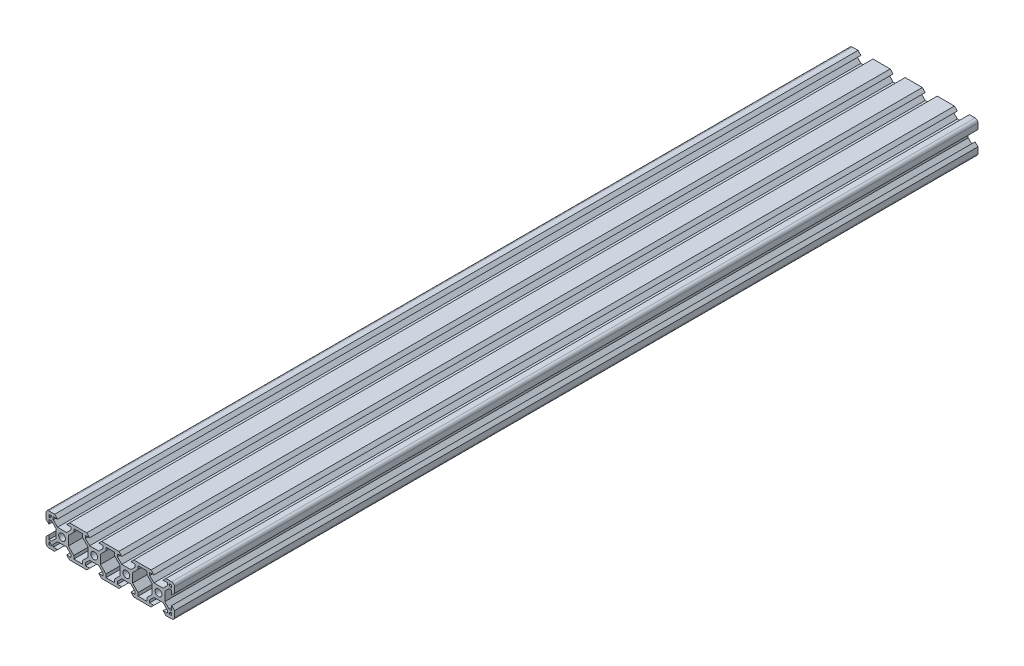
from build123d import *

# Parameters (mm, degrees)
ESQUISSE1_R        = 2.1
BOSS_EXTRU_1_DEPTH = 250


with BuildPart() as part:
    # Esquisse1 → Boss.-Extru.1 (new, symmetric)
    with BuildSketch(Plane.XY):
        with BuildLine():
            Line((-38.199999929, 10), (-34.639999675, 10))
            Line((-34.639999675, 10), (-32.839999603, 8.2))
            Line((-32.839999603, 8.2), (-35.499339671, 8.2))
            Line((-35.499339671, 8.2), (-35.499339671, 6.56))
            Line((-35.499339671, 6.56), (-32.839999603, 3.900660038))
            Line((-32.839999603, 3.900660038), (-27.159999603, 3.900660038))
            Line((-27.159999603, 3.900660038), (-24.500659536, 6.56))
            Line((-24.500659536, 6.56), (-24.500659536, 8.2))
            Line((-24.500659536, 8.2), (-27.159999603, 8.2))
            Line((-27.159999603, 8.2), (-25.359999532, 10))
            Line((-25.359999532, 10), (-14.640000468, 10))
            Line((-14.640000468, 10), (-12.840000397, 8.2))
            Line((-12.840000397, 8.2), (-15.499340464, 8.2))
            Line((-15.499340464, 8.2), (-15.499340464, 6.56))
            Line((-15.499340464, 6.56), (-12.840000397, 3.900660038))
            Line((-12.840000397, 3.900660038), (-7.159998809, 3.900660038))
            Line((-7.159998809, 3.900660038), (-4.500658742, 6.56))
            Line((-4.500658742, 6.56), (-4.500658742, 8.2))
            Line((-4.500658742, 8.2), (-7.159998809, 8.2))
            Line((-7.159998809, 8.2), (-5.359998738, 10))
            Line((-5.359998738, 10), (5.359998738, 10))
            Line((5.359998738, 10), (7.159998809, 8.2))
            Line((7.159998809, 8.2), (4.500658742, 8.2))
            Line((4.500658742, 8.2), (4.500658742, 6.56))
            Line((4.500658742, 6.56), (7.159998809, 3.900660038))
            Line((7.159998809, 3.900660038), (12.840000397, 3.900660038))
            Line((12.840000397, 3.900660038), (15.499340464, 6.56))
            Line((15.499340464, 6.56), (15.499340464, 8.2))
            Line((15.499340464, 8.2), (12.840000397, 8.2))
            Line((12.840000397, 8.2), (14.640000468, 10))
            Line((14.640000468, 10), (25.359999532, 10))
            Line((25.359999532, 10), (27.159999603, 8.2))
            Line((27.159999603, 8.2), (24.500659536, 8.2))
            Line((24.500659536, 8.2), (24.500659536, 6.56))
            Line((24.500659536, 6.56), (27.159999603, 3.900660038))
            Line((27.159999603, 3.900660038), (32.839999603, 3.900660038))
            Line((32.839999603, 3.900660038), (35.499339671, 6.56))
            Line((35.499339671, 6.56), (35.499339671, 8.2))
            Line((35.499339671, 8.2), (32.839999603, 8.2))
            Line((32.839999603, 8.2), (34.639999675, 10))
            Line((34.639999675, 10), (38.199999929, 10))
            ThreePointArc((38.199999929, 10), (39.47279216, 9.472792181), (39.999999929, 8.199999929))
            Line((39.999999929, 8.199999929), (39.999999787, 4.639999675))
            Line((39.999999787, 4.639999675), (38.199999716, 2.839999675))
            Line((38.199999716, 2.839999675), (38.199999821, 5.499339742))
            Line((38.199999821, 5.499339742), (36.559999821, 5.499339807))
            Line((36.559999821, 5.499339807), (33.900659754, 2.839999845))
            Line((33.900659754, 2.839999845), (33.900659641, 0))
            Line((33.900659641, 0), (33.900659754, -2.839999845))
            Line((33.900659754, -2.839999845), (36.559999821, -5.499339807))
            Line((36.559999821, -5.499339807), (38.199999821, -5.499339742))
            Line((38.199999821, -5.499339742), (38.199999716, -2.839999675))
            Line((38.199999716, -2.839999675), (39.999999787, -4.639999675))
            Line((39.999999787, -4.639999675), (39.999999929, -8.199999929))
            ThreePointArc((39.999999929, -8.199999929), (39.47279216, -9.472792181), (38.199999929, -10))
            Line((38.199999929, -10), (34.639999675, -10))
            Line((34.639999675, -10), (32.839999603, -8.2))
            Line((32.839999603, -8.2), (35.499339671, -8.2))
            Line((35.499339671, -8.2), (35.499339671, -6.56))
            Line((35.499339671, -6.56), (32.839999603, -3.900660038))
            Line((32.839999603, -3.900660038), (27.159999603, -3.900660038))
            Line((27.159999603, -3.900660038), (24.500659536, -6.56))
            Line((24.500659536, -6.56), (24.500659536, -8.2))
            Line((24.500659536, -8.2), (27.159999603, -8.2))
            Line((27.159999603, -8.2), (25.359999532, -10))
            Line((25.359999532, -10), (14.640000468, -10))
            Line((14.640000468, -10), (12.840000397, -8.2))
            Line((12.840000397, -8.2), (15.499340464, -8.2))
            Line((15.499340464, -8.2), (15.499340464, -6.56))
            Line((15.499340464, -6.56), (12.840000397, -3.900660038))
            Line((12.840000397, -3.900660038), (7.159998809, -3.900660038))
            Line((7.159998809, -3.900660038), (4.500658742, -6.56))
            Line((4.500658742, -6.56), (4.500658742, -8.2))
            Line((4.500658742, -8.2), (7.159998809, -8.2))
            Line((7.159998809, -8.2), (5.359998738, -10))
            Line((5.359998738, -10), (-5.359998738, -10))
            Line((-5.359998738, -10), (-7.159998809, -8.2))
            Line((-7.159998809, -8.2), (-4.500658742, -8.2))
            Line((-4.500658742, -8.2), (-4.500658742, -6.56))
            Line((-4.500658742, -6.56), (-7.159998809, -3.900660038))
            Line((-7.159998809, -3.900660038), (-12.840000397, -3.900660038))
            Line((-12.840000397, -3.900660038), (-15.499340464, -6.56))
            Line((-15.499340464, -6.56), (-15.499340464, -8.2))
            Line((-15.499340464, -8.2), (-12.840000397, -8.2))
            Line((-12.840000397, -8.2), (-14.640000468, -10))
            Line((-14.640000468, -10), (-25.359999532, -10))
            Line((-25.359999532, -10), (-27.159999603, -8.2))
            Line((-27.159999603, -8.2), (-24.500659536, -8.2))
            Line((-24.500659536, -8.2), (-24.500659536, -6.56))
            Line((-24.500659536, -6.56), (-27.159999603, -3.900660038))
            Line((-27.159999603, -3.900660038), (-32.839999603, -3.900660038))
            Line((-32.839999603, -3.900660038), (-35.499339671, -6.56))
            Line((-35.499339671, -6.56), (-35.499339671, -8.2))
            Line((-35.499339671, -8.2), (-32.839999603, -8.2))
            Line((-32.839999603, -8.2), (-34.639999675, -10))
            Line((-34.639999675, -10), (-38.199999929, -10))
            ThreePointArc((-38.199999929, -10), (-39.47279216, -9.472792181), (-39.999999929, -8.199999929))
            Line((-39.999999929, -8.199999929), (-39.999999787, -4.639999675))
            Line((-39.999999787, -4.639999675), (-38.199999716, -2.839999675))
            Line((-38.199999716, -2.839999675), (-38.199999821, -5.499339742))
            Line((-38.199999821, -5.499339742), (-36.559999821, -5.499339807))
            Line((-36.559999821, -5.499339807), (-33.900659754, -2.839999845))
            Line((-33.900659754, -2.839999845), (-33.900659641, 0))
            Line((-33.900659641, 0), (-33.900659754, 2.839999845))
            Line((-33.900659754, 2.839999845), (-36.559999821, 5.499339807))
            Line((-36.559999821, 5.499339807), (-38.199999821, 5.499339742))
            Line((-38.199999821, 5.499339742), (-38.199999716, 2.839999675))
            Line((-38.199999716, 2.839999675), (-39.999999787, 4.639999675))
            Line((-39.999999787, 4.639999675), (-39.999999929, 8.199999929))
            ThreePointArc((-39.999999929, 8.199999929), (-39.47279216, 9.472792181), (-38.199999929, 10))
        make_face()
        with Locations((-29.999999603, 0)):
            Circle(ESQUISSE1_R, mode=Mode.SUBTRACT)
        with Locations((-9.999999603, 0)):
            Circle(ESQUISSE1_R, mode=Mode.SUBTRACT)
        with Locations(Location((29.999999603, 0, 0), (0, 0, 180))):
            Circle(ESQUISSE1_R, mode=Mode.SUBTRACT)
        with Locations(Location((9.999999603, 0, 0), (0, 0, 180))):
            Circle(ESQUISSE1_R, mode=Mode.SUBTRACT)
        Polygon((-38.199999929, 8.2), (-38.199999864, 6.569339742), (-37.629999799, 6.569339742), (-36.569339648, 7.629999935), (-36.569339648, 8.2), align=None, mode=Mode.SUBTRACT)
        Polygon((-17.3, 6.239339079), (-17.3, 8.2), (-22.7, 8.2), (-22.7, 6.239339079), (-26.099339368, 2.839999845), (-26.099339368, -2.839999845), (-22.7, -6.239339079), (-22.7, -8.2), (-17.3, -8.2), (-17.3, -6.239339079), (-13.900660632, -2.839999845), (-13.900660632, 2.839999845), align=None, mode=Mode.SUBTRACT)
        Polygon((-6.099339678, -2.840000949), (-6.099339678, 2.840000949), (-2.700001413, 6.239339079), (-2.700001413, 8.2), (2.700001413, 8.2), (2.700001413, 6.239339079), (6.099339678, 2.840000949), (6.099339678, -2.840000949), (2.700001413, -6.239339079), (2.700001413, -8.2), (-2.700001413, -8.2), (-2.700001413, -6.239339079), align=None, mode=Mode.SUBTRACT)
        Polygon((-36.569339648, -7.629999935), (-36.569339648, -8.2), (-38.199999929, -8.2), (-38.199999864, -6.569339742), (-37.629999799, -6.569339742), align=None, mode=Mode.SUBTRACT)
        Polygon((36.569339648, 8.2), (38.199999929, 8.2), (38.199999864, 6.569339742), (37.629999799, 6.569339742), (36.569339648, 7.629999935), align=None, mode=Mode.SUBTRACT)
        Polygon((36.569339648, -8.2), (38.199999929, -8.2), (38.199999864, -6.569339742), (37.629999799, -6.569339742), (36.569339648, -7.629999935), align=None, mode=Mode.SUBTRACT)
        Polygon((13.900660632, -2.839999845), (17.3, -6.239339079), (17.3, -8.2), (22.7, -8.2), (22.7, -6.239339079), (26.099339368, -2.839999845), (26.099339368, 2.839999845), (22.7, 6.239339079), (22.7, 8.2), (17.3, 8.2), (17.3, 6.239339079), (13.900660632, 2.839999845), align=None, mode=Mode.SUBTRACT)
    extrude(amount=BOSS_EXTRU_1_DEPTH, both=True)


solid = part.part
